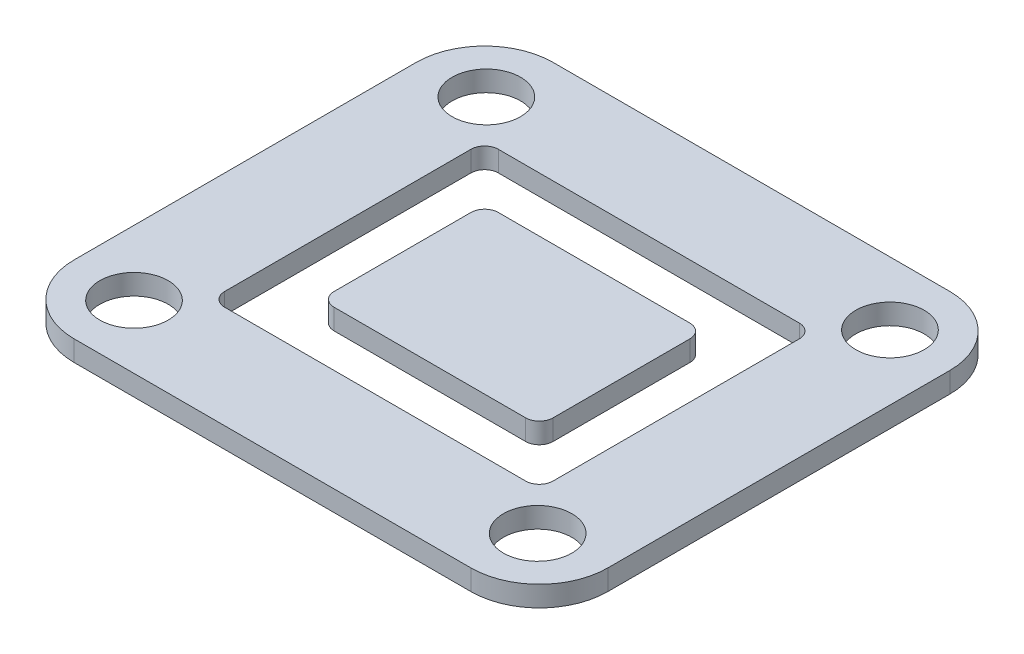
from build123d import *

# Parameters (mm, degrees)
SKETCH1_W             = 32
SKETCH1_H             = 24
BOSS_EXTRUDE1_DEPTH   = 3
SKETCH1_W_2           = 78
SKETCH1_H_2           = 70
SKETCH1_R             = 5
SKETCH1_W_3           = 48
SKETCH1_H_3           = 40
BOSS_EXTRUDE1_2_DEPTH = 3
FILLET1_R             = 2
FILLET2_R             = 10
FILLET3_R             = 2


with BuildPart() as part:
    # Sketch1 → Boss-Extrude1 (new body)
    with BuildSketch(Plane(origin=(0, 0, 0), x_dir=(1, 0, 0), z_dir=(0, 1, 0))):
        with Locations((-0.075399098, 4.950190099)):
            Rectangle(SKETCH1_W, SKETCH1_H)
    extrude(amount=BOSS_EXTRUDE1_DEPTH)

    # Fillet3
    fillet3_edges = [part.edges().sort_by_distance(p)[0] for p in [
        (15.924600902, 1.5, -16.950190099),
        (15.924600902, 1.5, 7.049809901),
        (-16.075399098, 1.5, 7.049809901),
        (-16.075399098, 1.5, -16.950190099),
    ]]
    fillet(fillet3_edges, radius=FILLET3_R)


with BuildPart() as body_2:
    # Sketch1 → Boss-Extrude1 2 (new body)
    with BuildSketch(Plane(origin=(0, 0, 0), x_dir=(1, 0, 0), z_dir=(0, 1, 0))):
        with Locations((-0.075399098, 4.950190099)):
            Rectangle(SKETCH1_W_2, SKETCH1_H_2)
        with Locations(Location((-29.575399098, -20.799809901, 0), (0, 0, 270))):
            Circle(SKETCH1_R, mode=Mode.SUBTRACT)
        with Locations(Location((-29.575399098, 30.700190099, 0), (0, 0, 270))):
            Circle(SKETCH1_R, mode=Mode.SUBTRACT)
        with Locations(Location((29.424600902, 30.700190099, 0), (0, 0, 270))):
            Circle(SKETCH1_R, mode=Mode.SUBTRACT)
        with Locations(Location((29.424600902, -20.799809901, 0), (0, 0, 270))):
            Circle(SKETCH1_R, mode=Mode.SUBTRACT)
        with Locations((-0.075399098, 4.950190099)):
            Rectangle(SKETCH1_W_3, SKETCH1_H_3, mode=Mode.SUBTRACT)
    extrude(amount=BOSS_EXTRUDE1_2_DEPTH)

    # Fillet1
    fillet1_edges = [body_2.edges().sort_by_distance(p)[0] for p in [
        (-24.075399098, 1.5, -24.950190099),
        (-24.075399098, 1.5, 15.049809901),
        (23.924600902, 1.5, 15.049809901),
        (23.924600902, 1.5, -24.950190099),
    ]]
    fillet(fillet1_edges, radius=FILLET1_R)

    # Fillet2
    fillet2_edges = [body_2.edges().sort_by_distance(p)[0] for p in [
        (38.924600902, 1.5, 30.049809901),
        (-39.075399098, 1.5, 30.049809901),
        (-39.075399098, 1.5, -39.950190099),
        (38.924600902, 1.5, -39.950190099),
    ]]
    fillet(fillet2_edges, radius=FILLET2_R)


solid = Compound([part.part, body_2.part])
